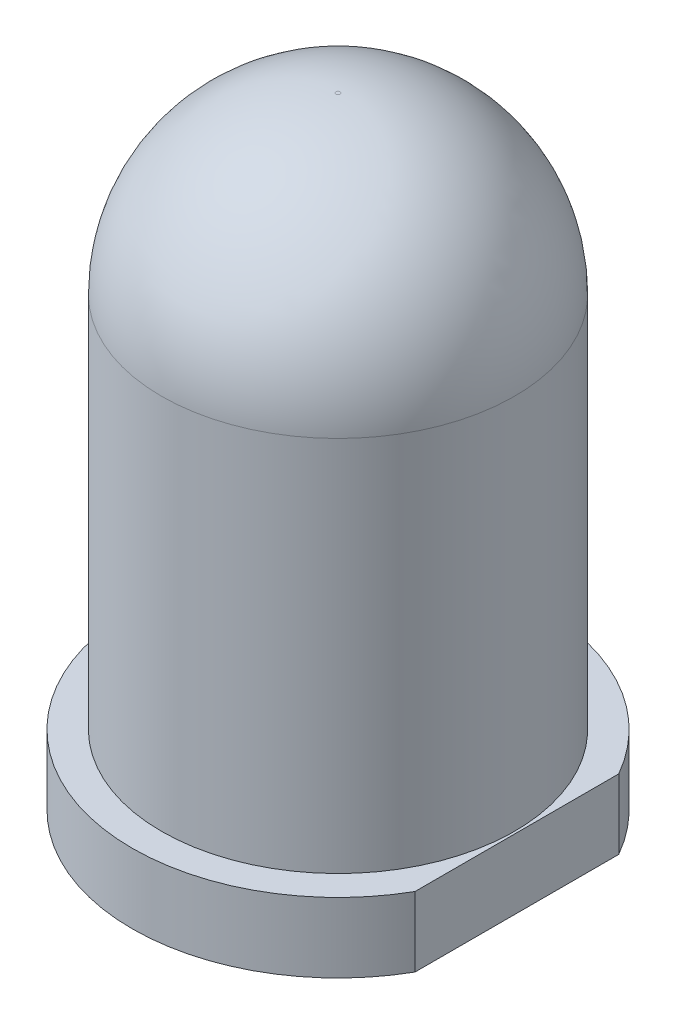
from build123d import *

# Parameters (mm, degrees)
BOSS_EXTRUDE1_DEPTH = 1
SKETCH2_W           = 2.53
SKETCH2_H           = 7.9
FILLET1_R           = 2.5


with BuildPart() as part:
    # Sketch1 → Boss-Extrude1 (new body)
    with BuildSketch(Plane.XZ):
        with BuildLine():
            Line((2.563221118, -1.460273091), (2.563221118, 1.460273091))
            ThreePointArc((2.563221118, 1.460273091), (-2.95, 0), (2.563221118, -1.460273091))
        make_face()
    extrude(amount=-BOSS_EXTRUDE1_DEPTH)

    # Sketch2 → Revolve1 (revolve)
    with BuildSketch(Plane(origin=(0, 0, 0), x_dir=(-1, 0, 0), z_dir=(0, 0, -1)), mode=Mode.PRIVATE) as revolve1_sk:
        with Locations((-1.265, 4.95)):
            Rectangle(SKETCH2_W, SKETCH2_H)
    revolve(revolve1_sk.sketch.rotate(Axis((0, 1, 0), (0, 1, 0)), 270), axis=Axis((0, 1, 0), (0, 1, 0)))

    # Fillet1
    fillet1_edges = [part.edges().sort_by_distance(p)[0] for p in [
        (0, 8.9, -2.53),
    ]]
    fillet(fillet1_edges, radius=FILLET1_R)


solid = part.part
